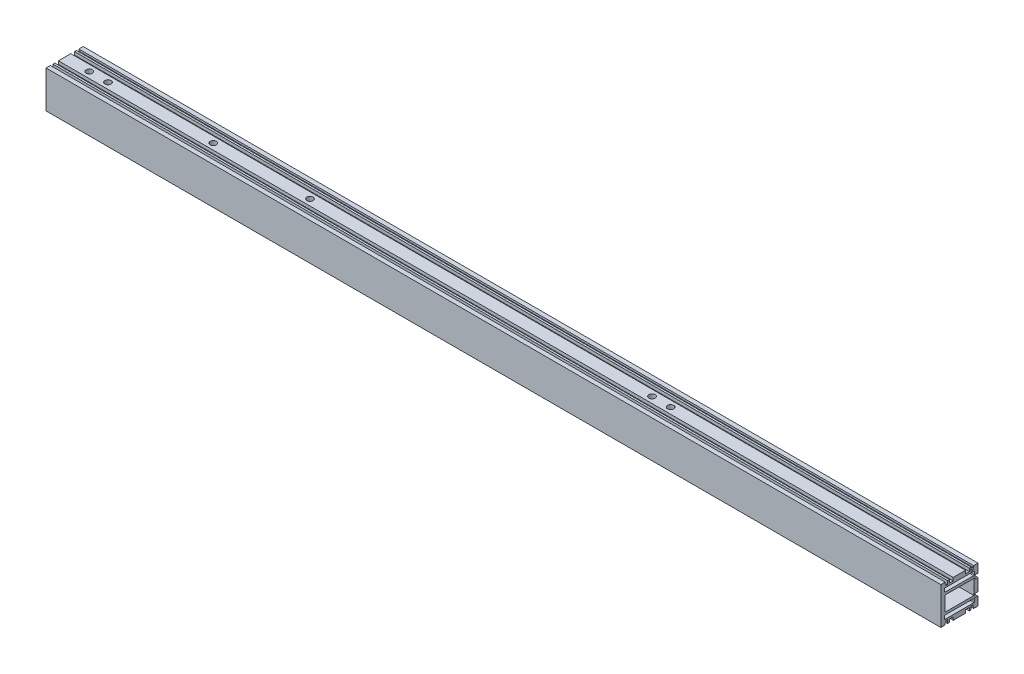
from build123d import *

# Parameters (mm, degrees)
SKETCH_1_W             = 23.5
SKETCH_1_H             = 12
EXTRUDE_1_DEPTH        = 361
HOLE_WIZARD_M6_1_D     = 5
HOLE_WIZARD_M6_1_DEPTH = 19
HOLE_WIZARD_M6_1_TIP   = 1.502151548
HOLE_WIZARD_M6_2_D     = 5
HOLE_WIZARD_M6_2_DEPTH = 19
HOLE_WIZARD_M6_2_TIP   = 1.502151548
HOLE_WIZARD_M6_3_D     = 5
HOLE_WIZARD_M6_3_DEPTH = 19
HOLE_WIZARD_M6_3_TIP   = 1.502151548


with BuildPart() as part:
    # 草图1 → 凸台-拉伸1 (new, symmetric)
    with BuildSketch(Plane(origin=(0, 0, 0), x_dir=(0, 0, -1), z_dir=(1, 0, 0))):
        Polygon((-15, 15), (-11.5, 15), (-11.5, 13.5), (-11, 13.5), (-11, 12), (-9.5, 12), (-9.5, 15), (-8, 15), (-8, 12.5), (-5, 12.5), (-5, 15), (5, 15), (5, 12.5), (8, 12.5), (8, 15), (9.5, 15), (9.5, 12), (11, 12), (11, 13.5), (11.5, 13.5), (11.5, 15), (15, 15), (15, 8), (12.5, 8), (12.5, 5), (15, 5), (15, -5), (12.5, -5), (12.5, -8), (15, -8), (15, -15), (11.5, -15), (11.5, -13.5), (11, -13.5), (11, -12), (9.5, -12), (9.5, -15), (8, -15), (8, -12.5), (5, -12.5), (5, -15), (-5, -15), (-5, -12.5), (-8, -12.5), (-8, -15), (-9.5, -15), (-9.5, -12), (-11, -12), (-11, -13.5), (-11.5, -13.5), (-11.5, -15), (-15, -15), align=None)
        with BuildLine():
            Line((12, -10.5), (12, -8.5))
            ThreePointArc((12, -8.5), (11.853553391, -8.146446609), (11.5, -8))
            Line((11.5, -8), (-11.5, -8))
            ThreePointArc((-11.5, -8), (-11.853553391, -8.146446609), (-12, -8.5))
            Line((-12, -8.5), (-12, -10.5))
            ThreePointArc((-12, -10.5), (-11.853553391, -10.853553391), (-11.5, -11))
            Line((-11.5, -11), (11.5, -11))
            ThreePointArc((11.5, -11), (11.853553391, -10.853553391), (12, -10.5))
        make_face(mode=Mode.SUBTRACT)
        with BuildLine():
            Line((-11.5, 11), (11.5, 11))
            ThreePointArc((11.5, 11), (11.853553391, 10.853553391), (12, 10.5))
            Line((12, 10.5), (12, 8.5))
            ThreePointArc((12, 8.5), (11.853553391, 8.146446609), (11.5, 8))
            Line((11.5, 8), (-11.5, 8))
            ThreePointArc((-11.5, 8), (-11.853553391, 8.146446609), (-12, 8.5))
            Line((-12, 8.5), (-12, 10.5))
            ThreePointArc((-12, 10.5), (-11.853553391, 10.853553391), (-11.5, 11))
        make_face(mode=Mode.SUBTRACT)
        Rectangle(SKETCH_1_W, SKETCH_1_H, mode=Mode.SUBTRACT)
    extrude(amount=EXTRUDE_1_DEPTH, both=True)

    # M6 螺纹孔1
    with Locations(Plane(origin=(0, -15, 0), x_dir=(-1, 0, 0), z_dir=(0, -1, 0))):
        with Locations((-341, 0), (-326, 0), (-246, 0), (-231, 0), (-161, 0), (-146, 0), (326, 0), (341, 0)):
            Hole(HOLE_WIZARD_M6_1_D / 2, depth=HOLE_WIZARD_M6_1_DEPTH)
            with Locations((0, 0, -(HOLE_WIZARD_M6_1_DEPTH + HOLE_WIZARD_M6_1_TIP / 2))):  # 118° drill point
                Cone(0, HOLE_WIZARD_M6_1_D / 2, HOLE_WIZARD_M6_1_TIP, mode=Mode.SUBTRACT)

    # M6 螺纹孔2
    with Locations(Plane(origin=(0, 15, 0), x_dir=(1, 0, 0), z_dir=(0, 1, 0))):
        with Locations((128, 0), (113, 0), (-341, 0), (-326, 0), (-241, 0), (-163, 0)):
            Hole(HOLE_WIZARD_M6_2_D / 2, depth=HOLE_WIZARD_M6_2_DEPTH)
            with Locations((0, 0, -(HOLE_WIZARD_M6_2_DEPTH + HOLE_WIZARD_M6_2_TIP / 2))):  # 118° drill point
                Cone(0, HOLE_WIZARD_M6_2_D / 2, HOLE_WIZARD_M6_2_TIP, mode=Mode.SUBTRACT)

    # M6 螺纹孔3
    with Locations(Plane(origin=(0, 0, -15), x_dir=(-1, 0, 0), z_dir=(0, 0, -1))):
        with Locations((-326, 0), (-341, 0)):
            Hole(HOLE_WIZARD_M6_3_D / 2, depth=HOLE_WIZARD_M6_3_DEPTH)
            with Locations((0, 0, -(HOLE_WIZARD_M6_3_DEPTH + HOLE_WIZARD_M6_3_TIP / 2))):  # 118° drill point
                Cone(0, HOLE_WIZARD_M6_3_D / 2, HOLE_WIZARD_M6_3_TIP, mode=Mode.SUBTRACT)


solid = part.part
